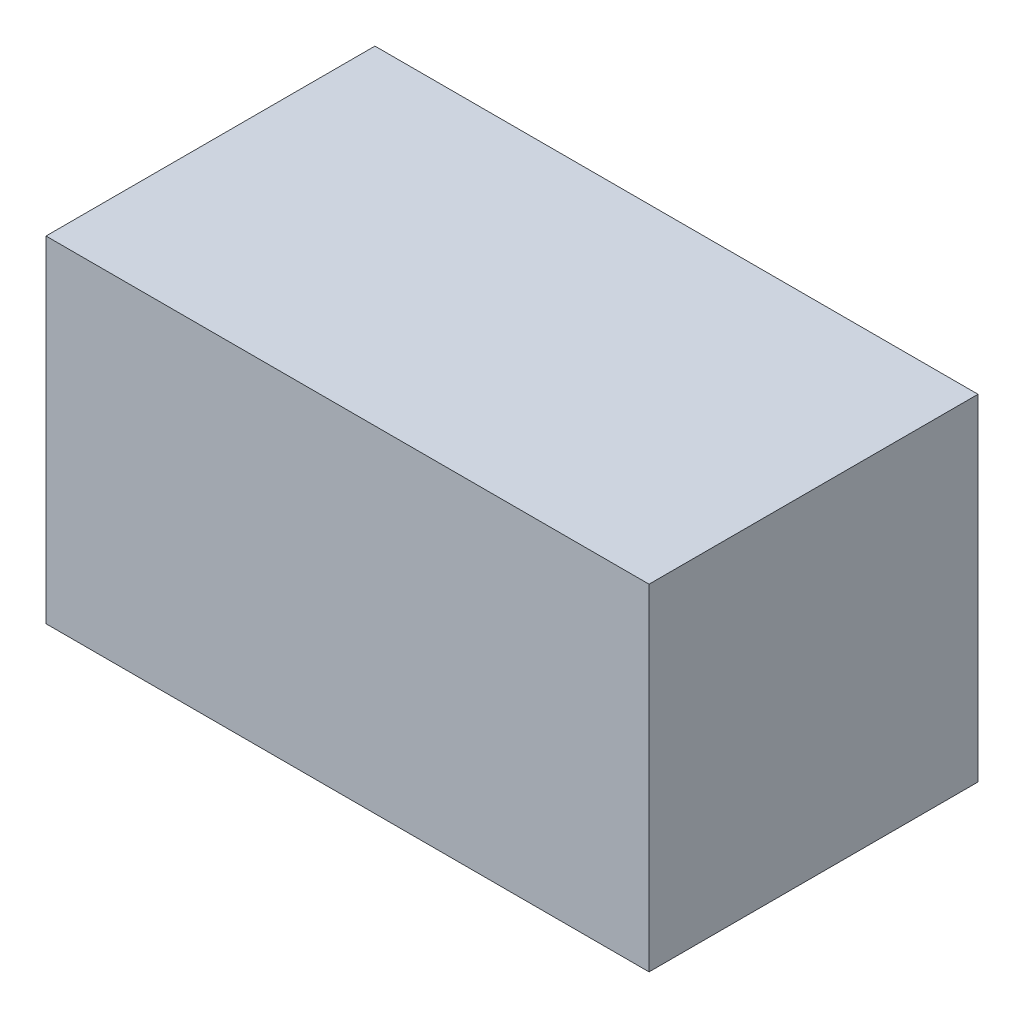
from build123d import *

# Parameters (mm, degrees)
SKETCH1_W           = 176
SKETCH1_H           = 96
BOSS_EXTRUDE1_DEPTH = 98


with BuildPart() as part:
    # Sketch1 → Boss-Extrude1 (new body)
    with BuildSketch(Plane(origin=(0, 0, 0), x_dir=(1, 0, 0), z_dir=(0, 1, 0))):
        Rectangle(SKETCH1_W, SKETCH1_H)
    extrude(amount=BOSS_EXTRUDE1_DEPTH)


solid = part.part
